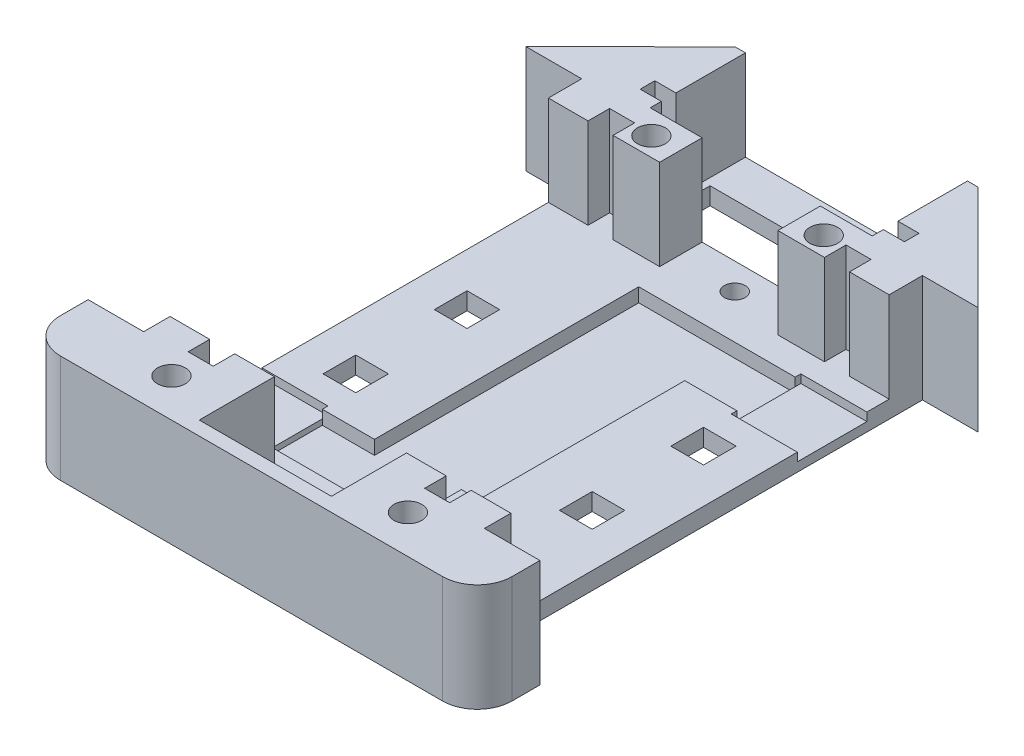
from build123d import *

# Parameters (mm, degrees)
SKETCH1_W           = 70
SKETCH1_H           = 85
BOSS_EXTRUDE1_DEPTH = 2.5
SKETCH2_W           = 10.5
SKETCH2_H           = 60
CUT_EXTRUDE1_DEPTH  = 10
SKETCH3_W           = 2.519429159
SKETCH3_H           = 8
CUT_EXTRUDE2_DEPTH  = 10
SKETCH4_W           = 4.7
SKETCH4_H           = 4.7
SKETCH4_W_2         = 29.9
SKETCH4_H_2         = 7.6
CUT_EXTRUDE3_DEPTH  = 10
BOSS_EXTRUDE2_DEPTH = 13
SKETCH8_W           = 10
SKETCH8_H           = 1.2
CUT_EXTRUDE6_DEPTH  = 9.5
SKETCH9_R           = 6.15
CUT_EXTRUDE7_DEPTH  = 20
SKETCH10_W          = 10
SKETCH10_H          = 1.2
CUT_EXTRUDE8_DEPTH  = 9.5
SKETCH11_R          = 6.15
CUT_EXTRUDE9_DEPTH  = 20
CUT_EXTRUDE10_DEPTH = 1.2
SKETCH13_W          = 3
SKETCH13_H          = 4.191956584
CUT_EXTRUDE11_DEPTH = 1.2
SKETCH15_R          = 1.5
CUT_EXTRUDE12_DEPTH = 10
SKETCH16_R          = 2
CUT_EXTRUDE13_DEPTH = 10
SKETCH17_W          = 64.961141682
SKETCH17_H          = 2
BOSS_EXTRUDE3_DEPTH = 15.5
FILLET1_R           = 5
SKETCH18_W          = 7.984996169
SKETCH18_H          = 62.989999862
CUT_EXTRUDE14_DEPTH = 50
CUT_EXTRUDE15_DEPTH = 2


with BuildPart() as part:
    # Sketch1 → Boss-Extrude1 (new body)
    with BuildSketch(Plane(origin=(0, 0, 0), x_dir=(1, 0, 0), z_dir=(0, 1, 0))):
        Rectangle(SKETCH1_W, SKETCH1_H)
    extrude(amount=BOSS_EXTRUDE1_DEPTH)

    # Sketch2 → Cut-Extrude1 (cut)
    with BuildSketch(Plane(origin=(0, 0, 0), x_dir=(-1, 0, 0), z_dir=(0, -1, 0))):
        with Locations((-29.75, -4.5)):
            Rectangle(SKETCH2_W, SKETCH2_H)
        with Locations((29.75, -4.5)):
            Rectangle(SKETCH2_W, SKETCH2_H)
    extrude(amount=-CUT_EXTRUDE1_DEPTH, mode=Mode.SUBTRACT)

    # Sketch3 → Cut-Extrude2 (cut)
    with BuildSketch(Plane(origin=(0, 2.5, 0), x_dir=(1, 0, 0), z_dir=(0, 1, 0))):
        Polygon((17.462549034, 42.5), (35, 42.5), (35, 25.5), (32.484854108, 25.5), (32.484996169, 27.489999862), align=None)
        with Locations((33.740285421, -38.5)):
            Rectangle(SKETCH3_W, SKETCH3_H)
        with Locations((-33.740285421, -38.5)):
            Rectangle(SKETCH3_W, SKETCH3_H)
        Polygon((-32.484996169, 27.489999862), (-17.462549034, 42.5), (-35, 42.5), (-35, 25.5), (-32.484854108, 25.5), align=None)
    extrude(amount=-CUT_EXTRUDE2_DEPTH, mode=Mode.SUBTRACT)

    # Sketch4 → Cut-Extrude3 (cut)
    with BuildSketch(Plane(origin=(0, 0, 0), x_dir=(-1, 0, 0), z_dir=(0, -1, 0))):
        with Locations((-17, 3.5)):
            Rectangle(SKETCH4_W, SKETCH4_H)
        with Locations((-17, -12.5)):
            Rectangle(SKETCH4_W, SKETCH4_H)
        with Locations((17, -12.5)):
            Rectangle(SKETCH4_W, SKETCH4_H)
        with Locations((17, 3.5)):
            Rectangle(SKETCH4_W, SKETCH4_H)
        with Locations((0, 32.6)):
            Rectangle(SKETCH4_W_2, SKETCH4_H_2)
    extrude(amount=-CUT_EXTRUDE3_DEPTH, mode=Mode.SUBTRACT)

    # Sketch5 → Boss-Extrude2 (add)
    with BuildSketch(Plane(origin=(0, 2.5, 0), x_dir=(1, 0, 0), z_dir=(0, 1, 0))):
        Polygon((-32.484996169, 27.489999862), (-32.484854108, 25.5), (-24.5, 25.5), (-24.5, 22.7), (-18.8, 22.7), (-18.8, 25.8), (-15.2, 25.8), (-15.2, 22.7), (-8.5, 22.7), (-8.5, 28.8), (-15.962549034, 28.8), (-15.962549034, 30.4), (-19, 30.4), (-19, 32.5), (-15.962549034, 32.5), (-15.962549034, 42.5), (-17.462549034, 42.5), align=None)
        Polygon((-9.5, -42.5), (-9.5, -31.7), (-15.2, -31.7), (-15.2, -34.8), (-18.8, -34.8), (-18.8, -31.7), (-24.5, -31.7), (-24.5, -34.5), (-32.480570841, -34.5), (-32.480570841, -42.5), align=None)
        Polygon((32.480570841, -42.5), (9.5, -42.5), (9.5, -31.7), (15.2, -31.7), (15.2, -34.8), (18.8, -34.8), (18.8, -31.7), (24.5, -31.7), (24.5, -34.5), (32.480570841, -34.5), align=None)
        Polygon((15.962549034, 30.4), (15.962549034, 28.8), (8.5, 28.8), (8.5, 22.7), (15.2, 22.7), (15.2, 25.8), (18.8, 25.8), (18.8, 22.7), (24.5, 22.7), (24.5, 25.5), (32.484854108, 25.5), (32.484996169, 27.489999862), (17.462549034, 42.5), (15.962549034, 42.5), (15.962549034, 32.5), (19, 32.5), (19, 30.4), align=None)
    extrude(amount=BOSS_EXTRUDE2_DEPTH)

    # Sketch8 → Cut-Extrude6 (cut)
    with BuildSketch(Plane.ZY.offset(24.5)):
        with Locations((23.5, 1.9)):
            Rectangle(SKETCH8_W, SKETCH8_H)
    extrude(amount=-CUT_EXTRUDE6_DEPTH, mode=Mode.SUBTRACT)

    # Sketch9 → Cut-Extrude7 (cut)
    with BuildSketch(Plane.ZY.offset(15)):
        with Locations((23.5, 7)):
            Circle(SKETCH9_R)
    extrude(amount=-CUT_EXTRUDE7_DEPTH, mode=Mode.SUBTRACT)

    # Sketch10 → Cut-Extrude8 (cut)
    with BuildSketch(Plane(origin=(24.5, 0, 0), x_dir=(0, 0, -1), z_dir=(1, 0, 0))):
        with Locations((14.5, 1.9)):
            Rectangle(SKETCH10_W, SKETCH10_H)
    extrude(amount=-CUT_EXTRUDE8_DEPTH, mode=Mode.SUBTRACT)

    # Sketch11 → Cut-Extrude9 (cut)
    with BuildSketch(Plane(origin=(15, 0, 0), x_dir=(0, 0, -1), z_dir=(1, 0, 0))):
        with Locations((14.5, 7)):
            Circle(SKETCH11_R)
    extrude(amount=-CUT_EXTRUDE9_DEPTH, mode=Mode.SUBTRACT)

    # Sketch12 → Cut-Extrude10 (cut)
    with BuildSketch(Plane(origin=(0, 2.5, 0), x_dir=(1, 0, 0), z_dir=(0, 1, 0))):
        Polygon((5, -19.308043416), (7.5, -19.308043416), (7.5, 10.308043416), (-7.5, 10.308043416), (-7.5, -19.308043416), align=None)
    extrude(amount=-CUT_EXTRUDE10_DEPTH, mode=Mode.SUBTRACT)

    # Sketch13 → Cut-Extrude11 (cut)
    with BuildSketch(Plane(origin=(0, 2.5, 0), x_dir=(1, 0, 0), z_dir=(0, 1, 0))):
        with Locations((-0.8, 12.404021708)):
            Rectangle(SKETCH13_W, SKETCH13_H)
        with Locations((0.8, -21.404021708)):
            Rectangle(SKETCH13_W, SKETCH13_H)
    extrude(amount=-CUT_EXTRUDE11_DEPTH, mode=Mode.SUBTRACT)

    # Sketch15 → Cut-Extrude12 (cut)
    with BuildSketch(Plane(origin=(0, 2.5, 0), x_dir=(1, 0, 0), z_dir=(0, 1, 0))):
        with Locations(Location((0, 25, 0), (0, 0, 270))):
            Circle(SKETCH15_R)
        with Locations(Location((0, -40, 0), (0, 0, 270))):
            Circle(SKETCH15_R)
    extrude(amount=-CUT_EXTRUDE12_DEPTH, mode=Mode.SUBTRACT)

    # Sketch16 → Cut-Extrude13 (cut)
    with BuildSketch(Plane(origin=(0, 15.5, 0), x_dir=(1, 0, 0), z_dir=(0, 1, 0))):
        with Locations(Location((12.39, 25.4, 0), (0, 0, 270))):
            Circle(SKETCH16_R)
        with Locations(Location((17, -39, 0), (0, 0, 270))):
            Circle(SKETCH16_R)
        with Locations(Location((-17, -39, 0), (0, 0, 90))):
            Circle(SKETCH16_R)
        with Locations(Location((-12.39, 25.4, 0), (0, 0, 90))):
            Circle(SKETCH16_R)
    extrude(amount=-CUT_EXTRUDE13_DEPTH, mode=Mode.SUBTRACT)

    # Sketch17 → Boss-Extrude3 (add)
    with BuildSketch(Plane(origin=(0, 0, 0), x_dir=(-1, 0, 0), z_dir=(0, -1, 0))):
        with Locations((0, -43.5)):
            Rectangle(SKETCH17_W, SKETCH17_H)
    extrude(amount=-BOSS_EXTRUDE3_DEPTH)

    # Fillet1
    fillet1_edges = [part.edges().sort_by_distance(p)[0] for p in [
        (-32.480570841, 7.75, 44.5),
        (32.480570841, 7.75, 44.5),
    ]]
    fillet(fillet1_edges, radius=FILLET1_R)

    # Sketch18 → Cut-Extrude14 (cut, symmetric)
    with BuildSketch(Plane(origin=(0, 2.5, 0), x_dir=(1, 0, 0), z_dir=(0, 1, 0))):
        with Locations((-28.492498084, -4.005000069)):
            Rectangle(SKETCH18_W, SKETCH18_H)
        with Locations((28.492498084, -4.005000069)):
            Rectangle(SKETCH18_W, SKETCH18_H)
    extrude(amount=CUT_EXTRUDE14_DEPTH, both=True, mode=Mode.SUBTRACT)

    # Sketch19 → Cut-Extrude15 (cut)
    with BuildSketch(Plane(origin=(0, 2.5, 0), x_dir=(1, 0, 0), z_dir=(0, 1, 0))):
        Polygon((15, 18.691956584), (-5, 18.691956584), (-7.5, 18.691956584), (-7.5, -19.308043416), (-15, -19.308043416), (-15, -27.691956584), (5, -27.691956584), (5, -19.308043416), (7.5, -19.308043416), (7.5, 10.308043416), (15, 10.308043416), align=None)
    extrude(amount=-CUT_EXTRUDE15_DEPTH, mode=Mode.SUBTRACT)


solid = part.part
